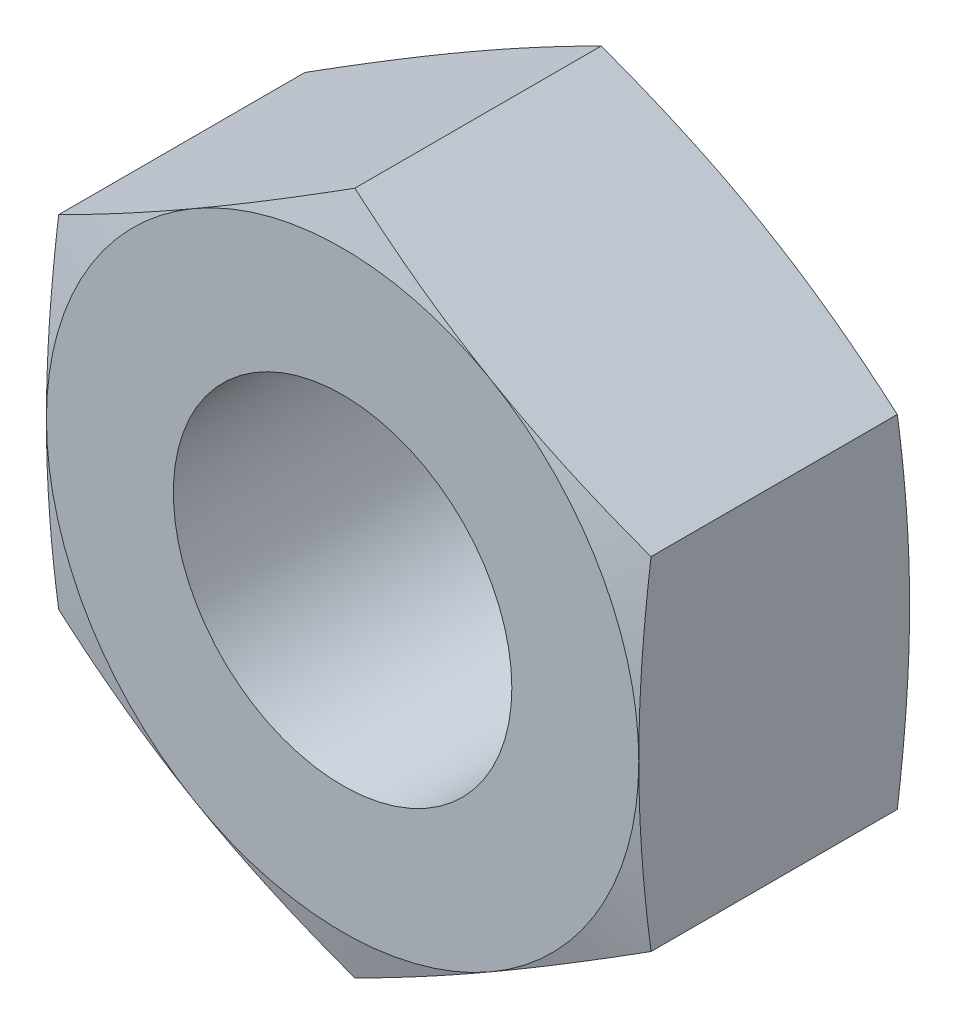
from build123d import *

# Parameters (mm, degrees)
SKETCH1_R           = 2
BOSS_EXTRUDE1_DEPTH = 3.2


with BuildPart() as part:
    # Sketch1 → Boss-Extrude1 (new body)
    with BuildSketch(Plane.XY):
        Polygon((0, 4.041451884), (-3.5, 2.020725942), (-3.5, -2.020725942), (0, -4.041451884), (3.5, -2.020725942), (3.5, 2.020725942), align=None)
        Circle(SKETCH1_R, mode=Mode.SUBTRACT)
    extrude(amount=BOSS_EXTRUDE1_DEPTH)

    # Sketch2 → Cut-Revolve2 (revolve, cut)
    with BuildSketch(Plane(origin=(0, 0, 0), x_dir=(0, 0, -1), z_dir=(0, 1, 0))):
        Polygon((-2.798076211, -5), (-4.003847577, -0.5), (-4.003847577, -5), align=None)
    cut_revolve2 = revolve(axis=Axis((0, 0, -2.80878951), (0, 0, 1)), mode=Mode.SUBTRACT)

    # Mirror1: Cut-Revolve2 across plane
    add(cut_revolve2.mirror(Plane.XY.offset(1.6)), mode=Mode.SUBTRACT)


solid = part.part
